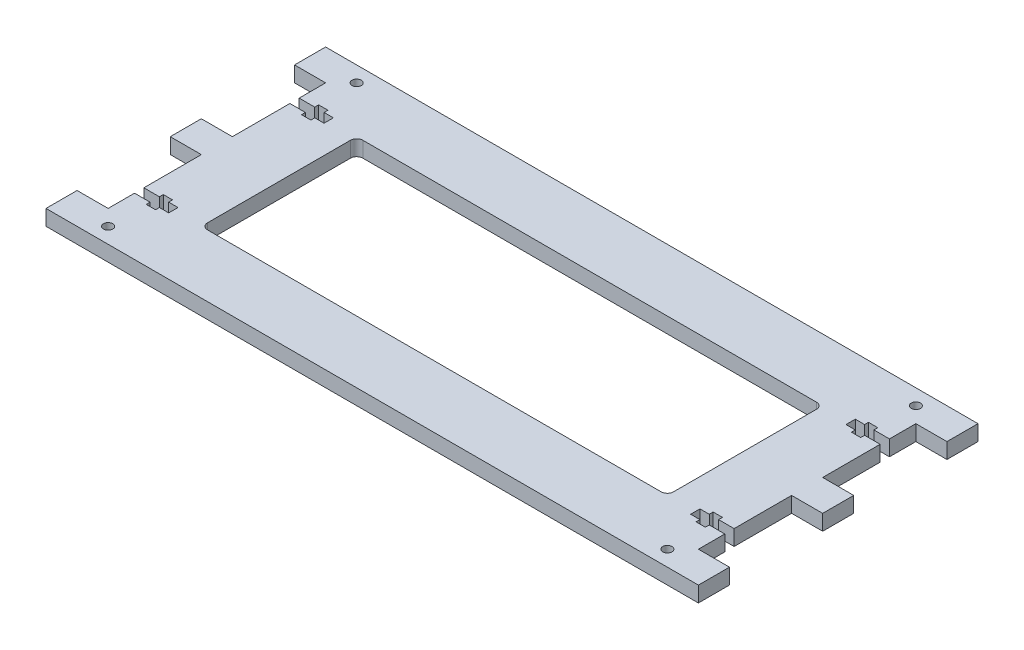
from build123d import *

# Parameters (mm, degrees)
SKETCH1_W           = 190
SKETCH1_H           = 90
SKETCH1_R           = 1.5
SKETCH1_W_2         = 150
SKETCH1_H_2         = 50
BOSS_EXTRUDE1_DEPTH = 5
FILLET1_R           = 2
CUT_EXTRUDE1_DEPTH  = 106.237825899
SKETCH3_W           = 10
SKETCH3_H           = 10
BOSS_EXTRUDE2_DEPTH = 5


with BuildPart() as part:
    # Sketch1 → Boss-Extrude1 (new body)
    with BuildSketch(Plane(origin=(0, 0, 0), x_dir=(1, 0, 0), z_dir=(0, 1, 0))):
        Rectangle(SKETCH1_W, SKETCH1_H)
        with Locations(Location((-90, 40, 0), (0, 0, 270))):
            Circle(SKETCH1_R, mode=Mode.SUBTRACT)
        with Locations(Location((-90, -40, 0), (0, 0, 270))):
            Circle(SKETCH1_R, mode=Mode.SUBTRACT)
        with Locations(Location((90, 40, 0), (0, 0, 270))):
            Circle(SKETCH1_R, mode=Mode.SUBTRACT)
        with Locations(Location((90, -40, 0), (0, 0, 270))):
            Circle(SKETCH1_R, mode=Mode.SUBTRACT)
        Rectangle(SKETCH1_W_2, SKETCH1_H_2, mode=Mode.SUBTRACT)
    extrude(amount=BOSS_EXTRUDE1_DEPTH)

    # Fillet1
    fillet1_edges = [part.edges().sort_by_distance(p)[0] for p in [
        (-75, 2.5, -25),
        (-75, 2.5, 25),
        (75, 2.5, 25),
        (75, 2.5, -25),
    ]]
    fillet(fillet1_edges, radius=FILLET1_R)

    # Sketch2 → Cut-Extrude1 (cut, through all)
    with BuildSketch(Plane(origin=(0, 5, 0), x_dir=(1, 0, 0), z_dir=(0, 1, 0))):
        Polygon((95, -23.5), (90, -23.5), (90, -22.25), (87, -22.25), (87, -23.5), (84, -23.5), (84, -26.5), (87, -26.5), (87, -27.75), (90, -27.75), (90, -26.5), (95, -26.5), align=None)
        Polygon((95, 26.5), (95, 23.5), (90, 23.5), (90, 22.25), (87, 22.25), (87, 23.5), (84, 23.5), (84, 26.5), (87, 26.5), (87, 27.75), (90, 27.75), (90, 26.5), align=None)
        Polygon((-95, 23.5), (-90, 23.5), (-90, 22.25), (-87, 22.25), (-87, 23.5), (-84, 23.5), (-84, 26.5), (-87, 26.5), (-87, 27.75), (-90, 27.75), (-90, 26.5), (-95, 26.5), align=None)
        Polygon((-95, -26.5), (-95, -23.5), (-90, -23.5), (-90, -22.25), (-87, -22.25), (-87, -23.5), (-84, -23.5), (-84, -26.5), (-87, -26.5), (-87, -27.75), (-90, -27.75), (-90, -26.5), align=None)
    extrude(amount=-CUT_EXTRUDE1_DEPTH, mode=Mode.SUBTRACT)

    # Sketch3 → Boss-Extrude2 (add)
    with BuildSketch(Plane(origin=(0, 5, 0), x_dir=(1, 0, 0), z_dir=(0, 1, 0))):
        with Locations((100, 40)):
            Rectangle(SKETCH3_W, SKETCH3_H)
        with Locations((100, 0)):
            Rectangle(SKETCH3_W, SKETCH3_H)
        with Locations((100, -40)):
            Rectangle(SKETCH3_W, SKETCH3_H)
        with Locations((-100, -40)):
            Rectangle(SKETCH3_W, SKETCH3_H)
        with Locations((-100, 0)):
            Rectangle(SKETCH3_W, SKETCH3_H)
        with Locations((-100, 40)):
            Rectangle(SKETCH3_W, SKETCH3_H)
    extrude(amount=-BOSS_EXTRUDE2_DEPTH)


solid = part.part
